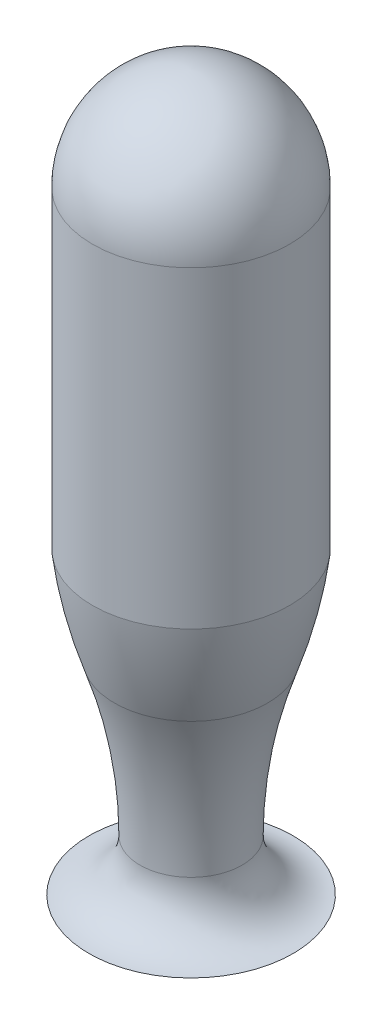
from build123d import *

# Parameters (mm, degrees)
CROQUIS2_R            = 1.5
CORTAR_EXTRUIR1_DEPTH = 10


with BuildPart() as part:
    # Croquis1 → Revolución1 (revolve)
    with BuildSketch(Plane.XY, mode=Mode.PRIVATE) as revoluci_n1_sk:
        with BuildLine():
            Line((0, -5.810793785), (0, 22.186814978))
            ThreePointArc((0, 22.186814978), (2.738614464, 20.96831032), (3.861709813, 18.189206215))
            Line((3.861709813, 18.189206215), (3.861709813, 5.931416864))
            ThreePointArc((3.861709813, 5.931416864), (3.528216573, 4.037892304), (3, 2.189206215))
            ThreePointArc((3, 2.189206215), (2.251712409, -0.76941252), (2, -3.810793785))
            ThreePointArc((2, -3.810793785), (2.585786438, -5.225007347), (4, -5.810793785))
            Line((4, -5.810793785), (0, -5.810793785))
        make_face()
    revolve(revoluci_n1_sk.sketch.rotate(Axis((0, -5.810793785, 0), (0, 1, 0)), 90), axis=Axis((0, -5.810793785, 0), (0, 1, 0)))

    # Croquis2 → Cortar-Extruir1 (cut)
    with BuildSketch(Plane.XZ.offset(5.810793785)):
        with Locations(Location((0, 0, 0), (0, 0, 270))):
            Circle(CROQUIS2_R)
    extrude(amount=-CORTAR_EXTRUIR1_DEPTH, mode=Mode.SUBTRACT)


solid = part.part
